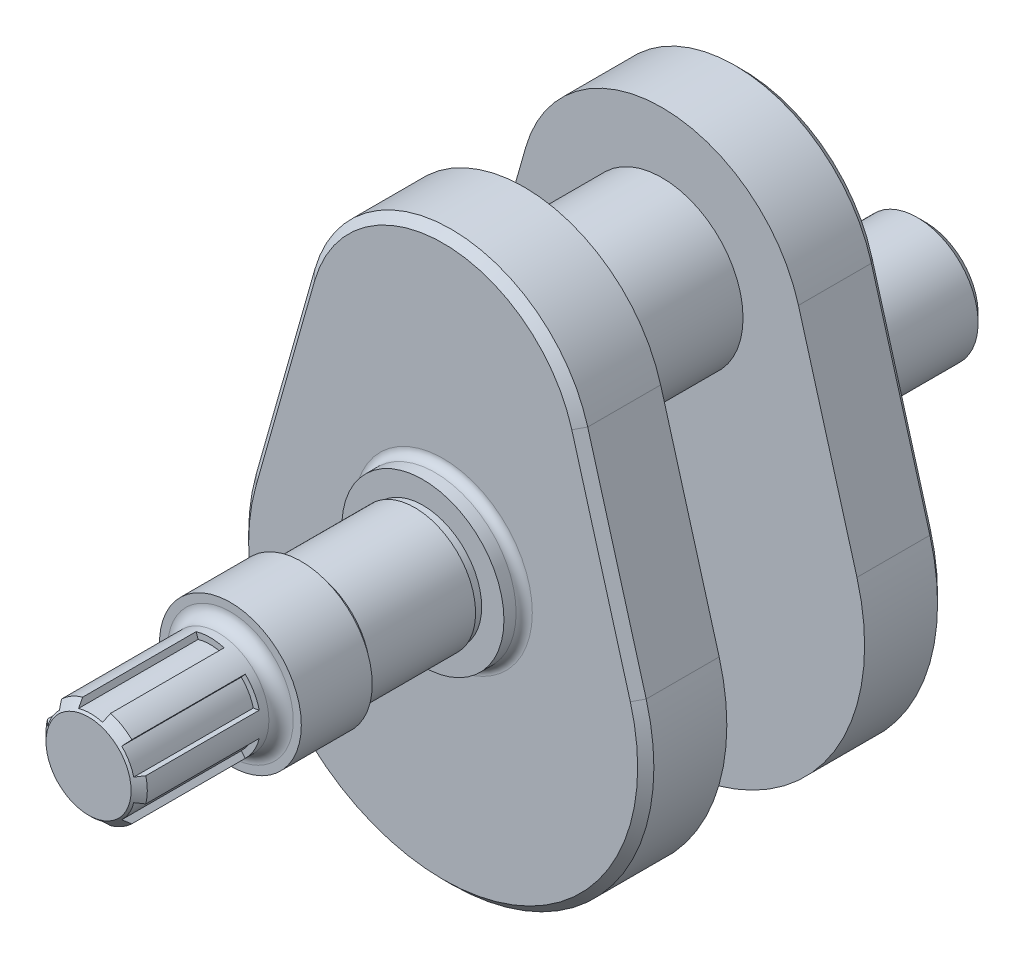
from build123d import *

# Parameters (mm, degrees)
SKETCH1_R                = 20
BOSS_EXTRUDE1_DEPTH      = 17
BOSS_EXTRUDE2_DEPTH      = 20
CHAMFER1_SIZE            = 2
SKETCH3_R                = 20
BOSS_EXTRUDE3_DEPTH      = 5
FILLET1_R                = 2
CHAMFER1_OF_MIRROR1_SIZE = 2
FILLET1_OF_MIRROR1_R     = 2
SKETCH4_R                = 14.5
BOSS_EXTRUDE4_DEPTH      = 2
SKETCH5_R                = 15
BOSS_EXTRUDE5_DEPTH      = 26
SKETCH6_R                = 14.5
BOSS_EXTRUDE6_DEPTH      = 2
BOSS_EXTRUDE7_START      = 40
SKETCH7_R                = 15
BOSS_EXTRUDE7_DEPTH      = 40
FILLET2_R                = 2
CHAMFER2_SIZE            = 2
SKETCH8_R                = 17.5
BOSS_EXTRUDE8_DEPTH      = 17.5
SKETCH9_R                = 12.5
BOSS_EXTRUDE9_DEPTH      = 35
FILLET3_R                = 3
CHAMFER3_SIZE            = 2
CUT_EXTRUDE1_START       = -30
CUT_EXTRUDE1_DEPTH       = 30
CIRPATTERN1_COUNT        = 6


with BuildPart() as part:
    # Sketch1 → Boss-Extrude1 (new, symmetric)
    with BuildSketch(Plane.XY):
        Circle(SKETCH1_R)
    extrude(amount=BOSS_EXTRUDE1_DEPTH, both=True)

    # Sketch2 → Boss-Extrude2 (add)
    with BuildSketch(Plane.XY.offset(17)):
        with BuildLine():
            Line((-33.673198504, 9.545454545), (-48.104569292, -41.363636364))
            ThreePointArc((-48.104569292, -41.363636364), (0, -105), (48.104569292, -41.363636364))
            Line((48.104569292, -41.363636364), (33.673198504, 9.545454545))
            ThreePointArc((33.673198504, 9.545454545), (0, 35), (-33.673198504, 9.545454545))
        make_face()
    boss_extrude2 = extrude(amount=BOSS_EXTRUDE2_DEPTH)

    # Chamfer1
    chamfer1_edges = [part.edges().sort_by_distance(p)[0] for p in [
        (0, 35, 37),
        (-40.888883898, -15.909090909, 37),
        (0, -105, 37),
        (40.888883898, -15.909090909, 37),
    ]]
    chamfer(chamfer1_edges, length=CHAMFER1_SIZE)

    # Sketch3 → Boss-Extrude3 (add)
    with BuildSketch(Plane.XY.offset(37)):
        with Locations((0, -35)):
            Circle(SKETCH3_R)
    boss_extrude3 = extrude(amount=BOSS_EXTRUDE3_DEPTH)

    # Fillet1
    fillet1_edges = [part.edges().sort_by_distance(p)[0] for p in [
        (-20, -35, 37),
    ]]
    fillet(fillet1_edges, radius=FILLET1_R)

    # Mirror1: Boss-Extrude2, Boss-Extrude3 across plane
    add(boss_extrude2.mirror(Plane.XY))
    add(boss_extrude3.mirror(Plane.XY))

    # Chamfer1 of Mirror1
    chamfer1_of_mirror1_edges = [part.edges().sort_by_distance(p)[0] for p in [
        (0, 35, -37),
        (-40.888883898, -15.909090909, -37),
        (0, -105, -37),
        (40.888883898, -15.909090909, -37),
    ]]
    chamfer(chamfer1_of_mirror1_edges, length=CHAMFER1_OF_MIRROR1_SIZE)

    # Fillet1 of Mirror1
    fillet1_of_mirror1_edges = [part.edges().sort_by_distance(p)[0] for p in [
        (-20, -35, -37),
    ]]
    fillet(fillet1_of_mirror1_edges, radius=FILLET1_OF_MIRROR1_R)

    # Sketch4 → Boss-Extrude4 (add)
    with BuildSketch(Plane.XY.offset(42)):
        with Locations((0, -35)):
            Circle(SKETCH4_R)
    extrude(amount=BOSS_EXTRUDE4_DEPTH)

    # Sketch5 → Boss-Extrude5 (add)
    with BuildSketch(Plane.XY.offset(44)):
        with Locations(Location((0, -35, 0), (0, 0, 180))):
            Circle(SKETCH5_R)
    extrude(amount=BOSS_EXTRUDE5_DEPTH)

    # Sketch6 → Boss-Extrude6 (add)
    with BuildSketch(Plane.XY.offset(70)):
        with Locations((0, -35)):
            Circle(SKETCH6_R)
    extrude(amount=BOSS_EXTRUDE6_DEPTH)

    # Sketch7 → Boss-Extrude7 (add)
    with BuildSketch(Plane(origin=(0, 0, -42), x_dir=(-1, 0, 0), z_dir=(0, 0, -1)).offset(BOSS_EXTRUDE7_START)):
        with Locations((0, -35)):
            Circle(SKETCH7_R)
    extrude(amount=-BOSS_EXTRUDE7_DEPTH)

    # Fillet2
    fillet2_edges = [part.edges().sort_by_distance(p)[0] for p in [
        (15, -35, -42),
    ]]
    fillet(fillet2_edges, radius=FILLET2_R)

    # Chamfer2
    chamfer2_edges = [part.edges().sort_by_distance(p)[0] for p in [
        (15, -35, -82),
    ]]
    chamfer(chamfer2_edges, length=CHAMFER2_SIZE)

    # Sketch8 → Boss-Extrude8 (add)
    with BuildSketch(Plane.XY.offset(72)):
        with Locations((0, -35)):
            Circle(SKETCH8_R)
    extrude(amount=BOSS_EXTRUDE8_DEPTH)

    # Sketch9 → Boss-Extrude9 (add)
    with BuildSketch(Plane.XY.offset(89.5)):
        with Locations((0, -35)):
            Circle(SKETCH9_R)
    extrude(amount=BOSS_EXTRUDE9_DEPTH)

    # Fillet3
    fillet3_edges = [part.edges().sort_by_distance(p)[0] for p in [
        (-12.5, -35, 89.5),
    ]]
    fillet(fillet3_edges, radius=FILLET3_R)

    # Chamfer3
    chamfer3_edges = [part.edges().sort_by_distance(p)[0] for p in [
        (-12.5, -35, 124.5),
    ]]
    chamfer(chamfer3_edges, length=CHAMFER3_SIZE)

    # Sketch10 → Cut-Extrude1 (cut)
    with BuildSketch(Plane.XY.offset(124.5).offset(CUT_EXTRUDE1_START)):
        with BuildLine():
            Line((-3.454445607, -22.986807021), (-2.962947983, -24.4065615))
            ThreePointArc((-2.962947983, -24.4065615), (0, -24), (2.962947983, -24.4065615))
            Line((2.962947983, -24.4065615), (3.454445607, -22.986807021))
            ThreePointArc((3.454445607, -22.986807021), (0, -22.5), (-3.454445607, -22.986807021))
        make_face()
    cut_extrude1 = extrude(amount=CUT_EXTRUDE1_DEPTH, mode=Mode.SUBTRACT)

    # CirPattern1: Cut-Extrude1 ×6 about axis
    cirpattern1_axis = Axis((0, -35, 0), (0, 0, 1))
    for i in range(1, CIRPATTERN1_COUNT):
        add(cut_extrude1.rotate(cirpattern1_axis, i * 360 / CIRPATTERN1_COUNT), mode=Mode.SUBTRACT)


solid = part.part
